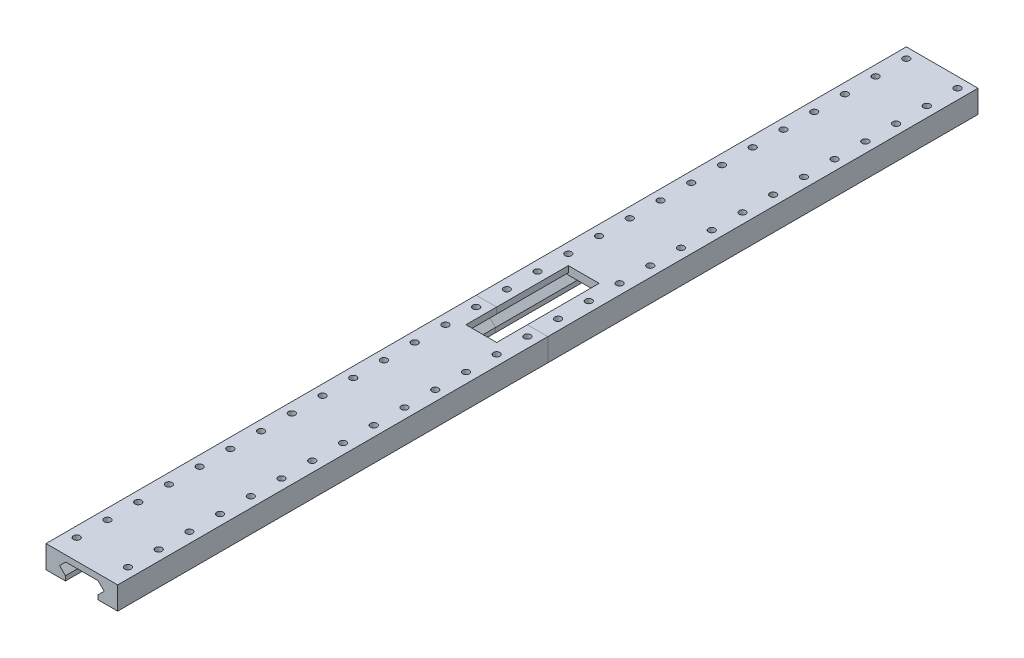
from build123d import *

# Parameters (mm, degrees)
EXTRUDE_2_DEPTH     = 420
SKETCH_3_R          = 1.6
CUT_EXTRUDE_1_DEPTH = 421.510951106
SKETCH_4_W          = 15
SKETCH_4_H          = 50
CUT_EXTRUDE_2_DEPTH = 421.510951106
SKETCH_7_W          = 15.765685424
SKETCH_7_H          = 1.5
EXTRUDE_3_DEPTH     = 1


with BuildPart() as part:
    # 草图1 → 凸台-拉伸2 (new body)
    with BuildSketch(Plane.XY):
        Polygon((8, 3.5), (17.5, 3.5), (17.5, 14.6), (-17.5, 14.6), (-17.5, 3.5), (-8, 3.5), (-8, 5.717157288), (-10.882842712, 8.6), (-7.882842712, 11.6), (7.882842712, 11.6), (10.882842712, 8.6), (8, 5.717157288), align=None)
    extrude(amount=EXTRUDE_2_DEPTH)

    # 草图3 → 切除-拉伸1 (cut, through all)
    with BuildSketch(Plane(origin=(0, 14.6, 0), x_dir=(1, 0, 0), z_dir=(0, 1, 0))):
        with Locations(Location((-12.5, -5, 0), (0, 0, 180))):
            Circle(SKETCH_3_R)
        with Locations(Location((-12.5, -20, 0), (0, 0, 180))):
            Circle(SKETCH_3_R)
        with Locations(Location((-12.5, -35, 0), (0, 0, 180))):
            Circle(SKETCH_3_R)
        with Locations(Location((-12.5, -50, 0), (0, 0, 180))):
            Circle(SKETCH_3_R)
        with Locations(Location((-12.5, -65, 0), (0, 0, 180))):
            Circle(SKETCH_3_R)
        with Locations(Location((-12.5, -80, 0), (0, 0, 180))):
            Circle(SKETCH_3_R)
        with Locations(Location((-12.5, -95, 0), (0, 0, 180))):
            Circle(SKETCH_3_R)
        with Locations(Location((-12.5, -110, 0), (0, 0, 180))):
            Circle(SKETCH_3_R)
        with Locations(Location((-12.5, -125, 0), (0, 0, 180))):
            Circle(SKETCH_3_R)
        with Locations(Location((-12.5, -140, 0), (0, 0, 180))):
            Circle(SKETCH_3_R)
        with Locations(Location((-12.5, -155, 0), (0, 0, 180))):
            Circle(SKETCH_3_R)
        with Locations(Location((-12.5, -170, 0), (0, 0, 180))):
            Circle(SKETCH_3_R)
        with Locations(Location((-12.5, -185, 0), (0, 0, 180))):
            Circle(SKETCH_3_R)
        with Locations(Location((-12.5, -200, 0), (0, 0, 180))):
            Circle(SKETCH_3_R)
        with Locations(Location((-12.5, -215, 0), (0, 0, 180))):
            Circle(SKETCH_3_R)
        with Locations(Location((-12.5, -230, 0), (0, 0, 180))):
            Circle(SKETCH_3_R)
        with Locations(Location((-12.5, -245, 0), (0, 0, 180))):
            Circle(SKETCH_3_R)
        with Locations(Location((-12.5, -260, 0), (0, 0, 180))):
            Circle(SKETCH_3_R)
        with Locations(Location((-12.5, -275, 0), (0, 0, 180))):
            Circle(SKETCH_3_R)
        with Locations(Location((-12.5, -290, 0), (0, 0, 180))):
            Circle(SKETCH_3_R)
        with Locations(Location((-12.5, -305, 0), (0, 0, 180))):
            Circle(SKETCH_3_R)
        with Locations(Location((-12.5, -320, 0), (0, 0, 180))):
            Circle(SKETCH_3_R)
        with Locations(Location((-12.5, -335, 0), (0, 0, 180))):
            Circle(SKETCH_3_R)
        with Locations(Location((-12.5, -350, 0), (0, 0, 180))):
            Circle(SKETCH_3_R)
        with Locations(Location((-12.5, -365, 0), (0, 0, 180))):
            Circle(SKETCH_3_R)
        with Locations(Location((-12.5, -380, 0), (0, 0, 180))):
            Circle(SKETCH_3_R)
        with Locations(Location((-12.5, -395, 0), (0, 0, 180))):
            Circle(SKETCH_3_R)
        with Locations(Location((-12.5, -410, 0), (0, 0, 180))):
            Circle(SKETCH_3_R)
        with Locations((12.5, -410)):
            Circle(SKETCH_3_R)
        with Locations((12.5, -395)):
            Circle(SKETCH_3_R)
        with Locations((12.5, -380)):
            Circle(SKETCH_3_R)
        with Locations((12.5, -365)):
            Circle(SKETCH_3_R)
        with Locations((12.5, -350)):
            Circle(SKETCH_3_R)
        with Locations((12.5, -335)):
            Circle(SKETCH_3_R)
        with Locations((12.5, -320)):
            Circle(SKETCH_3_R)
        with Locations((12.5, -305)):
            Circle(SKETCH_3_R)
        with Locations((12.5, -290)):
            Circle(SKETCH_3_R)
        with Locations((12.5, -275)):
            Circle(SKETCH_3_R)
        with Locations((12.5, -260)):
            Circle(SKETCH_3_R)
        with Locations((12.5, -245)):
            Circle(SKETCH_3_R)
        with Locations((12.5, -230)):
            Circle(SKETCH_3_R)
        with Locations((12.5, -215)):
            Circle(SKETCH_3_R)
        with Locations((12.5, -200)):
            Circle(SKETCH_3_R)
        with Locations((12.5, -185)):
            Circle(SKETCH_3_R)
        with Locations((12.5, -170)):
            Circle(SKETCH_3_R)
        with Locations((12.5, -155)):
            Circle(SKETCH_3_R)
        with Locations((12.5, -140)):
            Circle(SKETCH_3_R)
        with Locations((12.5, -125)):
            Circle(SKETCH_3_R)
        with Locations((12.5, -110)):
            Circle(SKETCH_3_R)
        with Locations((12.5, -95)):
            Circle(SKETCH_3_R)
        with Locations((12.5, -80)):
            Circle(SKETCH_3_R)
        with Locations((12.5, -65)):
            Circle(SKETCH_3_R)
        with Locations((12.5, -50)):
            Circle(SKETCH_3_R)
        with Locations((12.5, -35)):
            Circle(SKETCH_3_R)
        with Locations((12.5, -20)):
            Circle(SKETCH_3_R)
        with Locations((12.5, -5)):
            Circle(SKETCH_3_R)
    extrude(amount=-CUT_EXTRUDE_1_DEPTH, mode=Mode.SUBTRACT)

    # 草图4 → 切除-拉伸2 (cut, through all)
    with BuildSketch(Plane(origin=(0, 14.6, 0), x_dir=(1, 0, 0), z_dir=(0, 1, 0))):
        with Locations((0, -200)):
            Rectangle(SKETCH_4_W, SKETCH_4_H)
    extrude(amount=-CUT_EXTRUDE_2_DEPTH, mode=Mode.SUBTRACT)

    # 草图7 → 凸台-拉伸3 (add)
    with BuildSketch(Plane.XZ.offset(-11.6)):
        with Locations((0, 225.75)):
            Rectangle(SKETCH_7_W, SKETCH_7_H)
        with Locations((0, 174.25)):
            Rectangle(SKETCH_7_W, SKETCH_7_H)
    extrude(amount=EXTRUDE_3_DEPTH)


with BuildPart() as body_2:
    # Split Bodies 2: the piece on the far side of the plane
    add(part.part)
    split(bisect_by=Plane.XY.offset(210), keep=Keep.BOTTOM)


with BuildPart() as part_1:
    add(part.part)

    # Split Bodies 2
    split(bisect_by=Plane.XY.offset(210), keep=Keep.TOP)


solid = Compound([body_2.part, part_1.part])
